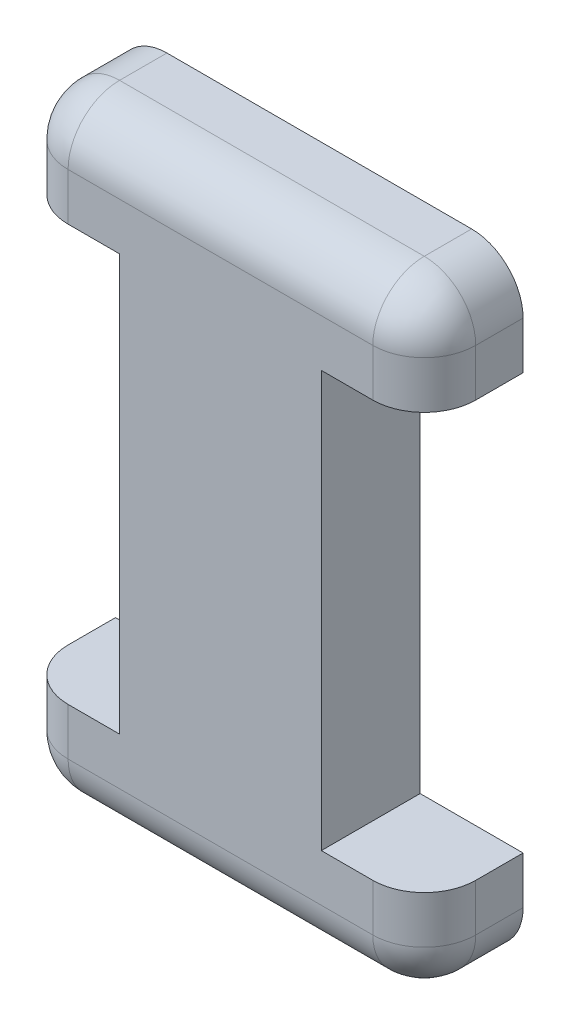
from build123d import *

# Parameters (mm, degrees)
BOSS_EXTRUDE1_DEPTH = 4.8
FILLET1_R           = 2.5


with BuildPart() as part:
    # Sketch1 → Boss-Extrude1 (new body)
    with BuildSketch(Plane(origin=(0, 0, 0), x_dir=(0, 1, 0), z_dir=(0, 0, 1))):
        Polygon((-15, -4.9), (-15, -9.9), (-19.8, -9.9), (-19.8, 9.9), (-15, 9.9), (-15, 4.9), (5.2, 4.9), (5.2, 9.9), (10, 9.9), (10, -9.9), (5.2, -9.9), (5.2, -4.9), align=None)
    extrude(amount=BOSS_EXTRUDE1_DEPTH)

    # Fillet1
    fillet1_edges = [part.edges().sort_by_distance(p)[0] for p in [
        (0, -19.8, 4.8),
        (-9.9, -17.4, 4.8),
        (9.9, 10, 2.4),
        (-9.9, 10, 2.4),
        (-9.9, -19.8, 2.4),
        (9.9, -19.8, 2.4),
        (-9.9, 7.6, 4.8),
        (0, 10, 4.8),
        (9.9, 7.6, 4.8),
        (9.9, -17.4, 4.8),
    ]]
    fillet(fillet1_edges, radius=FILLET1_R)


solid = part.part
